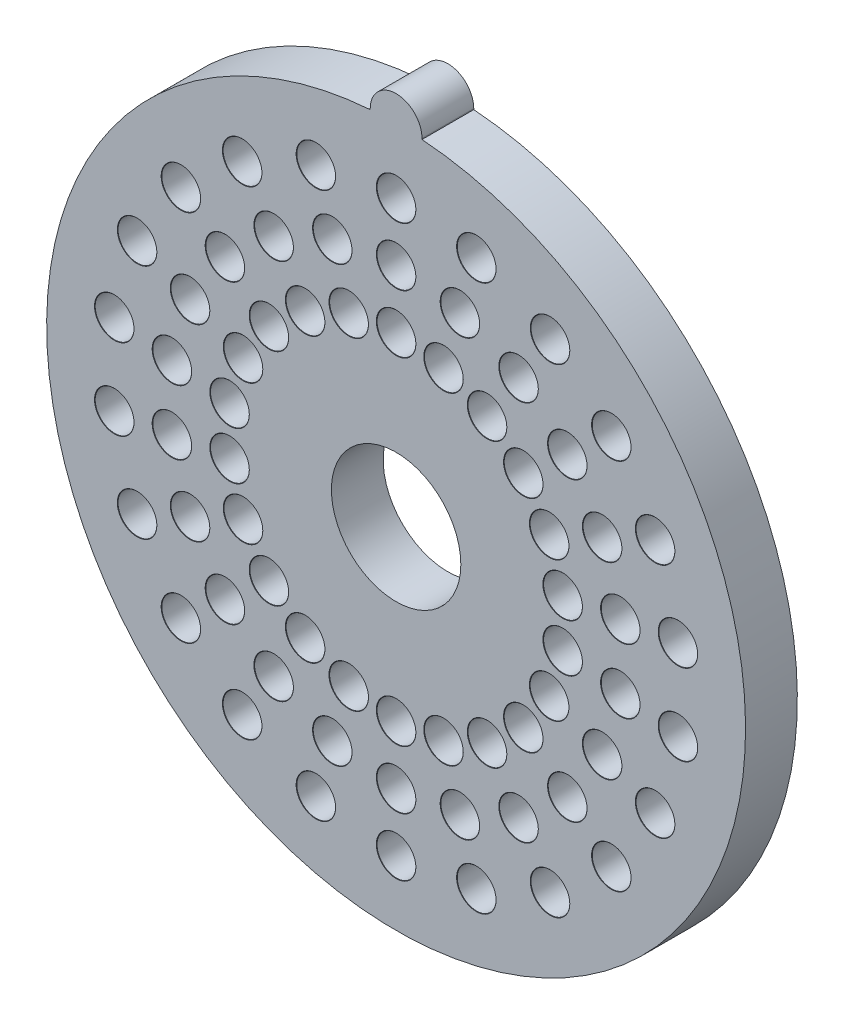
from build123d import *

# Parameters (mm, degrees)
BOSS_EXTRUDE1_DEPTH             = 4
F_3_0MM_DOWEL_HOLE1_D           = 3
F_3_0MM_DOWEL_HOLE1_CSINK_D     = 3.05
F_3_0MM_DOWEL_HOLE1_CSINK_ANGLE = 90
LPATTERN1_COUNT                 = 3
LPATTERN1_PITCH                 = 4.5
CIRPATTERN2_COUNT               = 22
CIRPATTERN2_COPY_1_D            = 3
CIRPATTERN2_COPY_1_CSINK_D      = 3.05
CIRPATTERN2_COPY_1_CSINK_ANGLE  = 90
CIRPATTERN2_COPY_2_D            = 3
CIRPATTERN2_COPY_2_CSINK_D      = 3.05
CIRPATTERN2_COPY_2_CSINK_ANGLE  = 90
CIRPATTERN2_COPY_3_D            = 3
CIRPATTERN2_COPY_3_CSINK_D      = 3.05
CIRPATTERN2_COPY_3_CSINK_ANGLE  = 90
CIRPATTERN2_COPY_4_D            = 3
CIRPATTERN2_COPY_4_CSINK_D      = 3.05
CIRPATTERN2_COPY_4_CSINK_ANGLE  = 90
CIRPATTERN2_COPY_5_D            = 3
CIRPATTERN2_COPY_5_CSINK_D      = 3.05
CIRPATTERN2_COPY_5_CSINK_ANGLE  = 90
CIRPATTERN2_COPY_6_D            = 3
CIRPATTERN2_COPY_6_CSINK_D      = 3.05
CIRPATTERN2_COPY_6_CSINK_ANGLE  = 90
CIRPATTERN2_COPY_7_D            = 3
CIRPATTERN2_COPY_7_CSINK_D      = 3.05
CIRPATTERN2_COPY_7_CSINK_ANGLE  = 90
CIRPATTERN2_COPY_8_D            = 3
CIRPATTERN2_COPY_8_CSINK_D      = 3.05
CIRPATTERN2_COPY_8_CSINK_ANGLE  = 90
CIRPATTERN2_COPY_9_D            = 3
CIRPATTERN2_COPY_9_CSINK_D      = 3.05
CIRPATTERN2_COPY_9_CSINK_ANGLE  = 90
CIRPATTERN2_COPY_10_D           = 3
CIRPATTERN2_COPY_10_CSINK_D     = 3.05
CIRPATTERN2_COPY_10_CSINK_ANGLE = 90
CIRPATTERN2_COPY_11_D           = 3
CIRPATTERN2_COPY_11_CSINK_D     = 3.05
CIRPATTERN2_COPY_11_CSINK_ANGLE = 90
CIRPATTERN2_COPY_12_D           = 3
CIRPATTERN2_COPY_12_CSINK_D     = 3.05
CIRPATTERN2_COPY_12_CSINK_ANGLE = 90
CIRPATTERN2_COPY_13_D           = 3
CIRPATTERN2_COPY_13_CSINK_D     = 3.05
CIRPATTERN2_COPY_13_CSINK_ANGLE = 90
CIRPATTERN2_COPY_14_D           = 3
CIRPATTERN2_COPY_14_CSINK_D     = 3.05
CIRPATTERN2_COPY_14_CSINK_ANGLE = 90
CIRPATTERN2_COPY_15_D           = 3
CIRPATTERN2_COPY_15_CSINK_D     = 3.05
CIRPATTERN2_COPY_15_CSINK_ANGLE = 90
CIRPATTERN2_COPY_16_D           = 3
CIRPATTERN2_COPY_16_CSINK_D     = 3.05
CIRPATTERN2_COPY_16_CSINK_ANGLE = 90
CIRPATTERN2_COPY_17_D           = 3
CIRPATTERN2_COPY_17_CSINK_D     = 3.05
CIRPATTERN2_COPY_17_CSINK_ANGLE = 90
CIRPATTERN2_COPY_18_D           = 3
CIRPATTERN2_COPY_18_CSINK_D     = 3.05
CIRPATTERN2_COPY_18_CSINK_ANGLE = 90
CIRPATTERN2_COPY_19_D           = 3
CIRPATTERN2_COPY_19_CSINK_D     = 3.05
CIRPATTERN2_COPY_19_CSINK_ANGLE = 90
CIRPATTERN2_COPY_20_D           = 3
CIRPATTERN2_COPY_20_CSINK_D     = 3.05
CIRPATTERN2_COPY_20_CSINK_ANGLE = 90
CIRPATTERN2_COPY_21_D           = 3
CIRPATTERN2_COPY_21_CSINK_D     = 3.05
CIRPATTERN2_COPY_21_CSINK_ANGLE = 90
CIRPATTERN2_COPY_22_D           = 3
CIRPATTERN2_COPY_22_CSINK_D     = 3.05
CIRPATTERN2_COPY_22_CSINK_ANGLE = 90
CIRPATTERN2_COPY_23_D           = 3
CIRPATTERN2_COPY_23_CSINK_D     = 3.05
CIRPATTERN2_COPY_23_CSINK_ANGLE = 90
CIRPATTERN2_COPY_24_D           = 3
CIRPATTERN2_COPY_24_CSINK_D     = 3.05
CIRPATTERN2_COPY_24_CSINK_ANGLE = 90
CIRPATTERN2_COPY_25_D           = 3
CIRPATTERN2_COPY_25_CSINK_D     = 3.05
CIRPATTERN2_COPY_25_CSINK_ANGLE = 90
CIRPATTERN2_COPY_26_D           = 3
CIRPATTERN2_COPY_26_CSINK_D     = 3.05
CIRPATTERN2_COPY_26_CSINK_ANGLE = 90
CIRPATTERN2_COPY_27_D           = 3
CIRPATTERN2_COPY_27_CSINK_D     = 3.05
CIRPATTERN2_COPY_27_CSINK_ANGLE = 90
CIRPATTERN2_COPY_28_D           = 3
CIRPATTERN2_COPY_28_CSINK_D     = 3.05
CIRPATTERN2_COPY_28_CSINK_ANGLE = 90
CIRPATTERN2_COPY_29_D           = 3
CIRPATTERN2_COPY_29_CSINK_D     = 3.05
CIRPATTERN2_COPY_29_CSINK_ANGLE = 90
CIRPATTERN2_COPY_30_D           = 3
CIRPATTERN2_COPY_30_CSINK_D     = 3.05
CIRPATTERN2_COPY_30_CSINK_ANGLE = 90
CIRPATTERN2_COPY_31_D           = 3
CIRPATTERN2_COPY_31_CSINK_D     = 3.05
CIRPATTERN2_COPY_31_CSINK_ANGLE = 90
CIRPATTERN2_COPY_32_D           = 3
CIRPATTERN2_COPY_32_CSINK_D     = 3.05
CIRPATTERN2_COPY_32_CSINK_ANGLE = 90
CIRPATTERN2_COPY_33_D           = 3
CIRPATTERN2_COPY_33_CSINK_D     = 3.05
CIRPATTERN2_COPY_33_CSINK_ANGLE = 90
CIRPATTERN2_COPY_34_D           = 3
CIRPATTERN2_COPY_34_CSINK_D     = 3.05
CIRPATTERN2_COPY_34_CSINK_ANGLE = 90
CIRPATTERN2_COPY_35_D           = 3
CIRPATTERN2_COPY_35_CSINK_D     = 3.05
CIRPATTERN2_COPY_35_CSINK_ANGLE = 90
CIRPATTERN2_COPY_36_D           = 3
CIRPATTERN2_COPY_36_CSINK_D     = 3.05
CIRPATTERN2_COPY_36_CSINK_ANGLE = 90
CIRPATTERN2_COPY_37_D           = 3
CIRPATTERN2_COPY_37_CSINK_D     = 3.05
CIRPATTERN2_COPY_37_CSINK_ANGLE = 90
CIRPATTERN2_COPY_38_D           = 3
CIRPATTERN2_COPY_38_CSINK_D     = 3.05
CIRPATTERN2_COPY_38_CSINK_ANGLE = 90
CIRPATTERN2_COPY_39_D           = 3
CIRPATTERN2_COPY_39_CSINK_D     = 3.05
CIRPATTERN2_COPY_39_CSINK_ANGLE = 90
CIRPATTERN2_COPY_40_D           = 3
CIRPATTERN2_COPY_40_CSINK_D     = 3.05
CIRPATTERN2_COPY_40_CSINK_ANGLE = 90
CIRPATTERN2_COPY_41_D           = 3
CIRPATTERN2_COPY_41_CSINK_D     = 3.05
CIRPATTERN2_COPY_41_CSINK_ANGLE = 90
CIRPATTERN2_COPY_42_D           = 3
CIRPATTERN2_COPY_42_CSINK_D     = 3.05
CIRPATTERN2_COPY_42_CSINK_ANGLE = 90
SKETCH4_R                       = 5
CUT_EXTRUDE1_DEPTH              = 40.824615503


with BuildPart() as part:
    # Sketch1 → Boss-Extrude1 (new body)
    with BuildSketch(Plane.XY):
        with BuildLine():
            Line((-2, 26.925824036), (-2, 27))
            ThreePointArc((-2, 27), (0, 29), (2, 27))
            Line((2, 27), (2, 26.925824036))
            ThreePointArc((2, 26.925824036), (0, -27), (-2, 26.925824036))
        make_face()
    extrude(amount=BOSS_EXTRUDE1_DEPTH)

    # Ø3.0mm Dowel Hole1 (through all)
    with Locations(Plane.XY.offset(4)):
        with Locations((0, 22)):
            f_3_0mm_dowel_hole1 = CounterSinkHole(F_3_0MM_DOWEL_HOLE1_D / 2, F_3_0MM_DOWEL_HOLE1_CSINK_D / 2, counter_sink_angle=F_3_0MM_DOWEL_HOLE1_CSINK_ANGLE)

    # LPattern1: Ø3.0mm Dowel Hole1 ×3
    with Locations(*[(0, -i * LPATTERN1_PITCH, 0) for i in range(1, LPATTERN1_COUNT)]):
        add(f_3_0mm_dowel_hole1, mode=Mode.SUBTRACT)

    # CirPattern2: Ø3.0mm Dowel Hole1 ×22 about axis
    cirpattern2_axis = Axis((0, 0, 0), (0, 0, 1))
    for i in range(1, CIRPATTERN2_COUNT):
        add(f_3_0mm_dowel_hole1.rotate(cirpattern2_axis, i * 360 / CIRPATTERN2_COUNT), mode=Mode.SUBTRACT)

    # CirPattern2 copy 1 (through all)
    with Locations(Plane(origin=(1.267796506, -4.317718381, 4), x_dir=(0.9594929736144974, 0.28173255684142967, 0), z_dir=(0, 0, 1))):
        with Locations((0, 22)):
            CounterSinkHole(CIRPATTERN2_COPY_1_D / 2, CIRPATTERN2_COPY_1_CSINK_D / 2, counter_sink_angle=CIRPATTERN2_COPY_1_CSINK_ANGLE)

    # CirPattern2 copy 2 (through all)
    with Locations(Plane(origin=(2.432883679, -3.785640898, 4), x_dir=(0.8412535328311812, 0.5406408174555976, 0), z_dir=(0, 0, 1))):
        with Locations((0, 22)):
            CounterSinkHole(CIRPATTERN2_COPY_2_D / 2, CIRPATTERN2_COPY_2_CSINK_D / 2, counter_sink_angle=CIRPATTERN2_COPY_2_CSINK_ANGLE)

    # CirPattern2 copy 3 (through all)
    with Locations(Plane(origin=(3.400873085, -2.946873303, 4), x_dir=(0.654860733945285, 0.7557495743542583, 0), z_dir=(0, 0, 1))):
        with Locations((0, 22)):
            CounterSinkHole(CIRPATTERN2_COPY_3_D / 2, CIRPATTERN2_COPY_3_CSINK_D / 2, counter_sink_angle=CIRPATTERN2_COPY_3_CSINK_ANGLE)

    # CirPattern2 copy 4 (through all)
    with Locations(Plane(origin=(4.093343979, -1.869367559, 4), x_dir=(0.41541501300188644, 0.9096319953545183, 0), z_dir=(0, 0, 1))):
        with Locations((0, 22)):
            CounterSinkHole(CIRPATTERN2_COPY_4_D / 2, CIRPATTERN2_COPY_4_CSINK_D / 2, counter_sink_angle=CIRPATTERN2_COPY_4_CSINK_ANGLE)

    # CirPattern2 copy 5 (through all)
    with Locations(Plane(origin=(4.454196488, -0.640416772, 4), x_dir=(0.14231483827328534, 0.9898214418809327, 0), z_dir=(0, 0, 1))):
        with Locations((0, 22)):
            CounterSinkHole(CIRPATTERN2_COPY_5_D / 2, CIRPATTERN2_COPY_5_CSINK_D / 2, counter_sink_angle=CIRPATTERN2_COPY_5_CSINK_ANGLE)

    # CirPattern2 copy 6 (through all)
    with Locations(Plane(origin=(4.454196488, 0.640416772, 4), x_dir=(-0.14231483827328523, 0.9898214418809327, 0), z_dir=(0, 0, 1))):
        with Locations((0, 22)):
            CounterSinkHole(CIRPATTERN2_COPY_6_D / 2, CIRPATTERN2_COPY_6_CSINK_D / 2, counter_sink_angle=CIRPATTERN2_COPY_6_CSINK_ANGLE)

    # CirPattern2 copy 7 (through all)
    with Locations(Plane(origin=(4.093343979, 1.869367559, 4), x_dir=(-0.4154150130018863, 0.9096319953545184, 0), z_dir=(0, 0, 1))):
        with Locations((0, 22)):
            CounterSinkHole(CIRPATTERN2_COPY_7_D / 2, CIRPATTERN2_COPY_7_CSINK_D / 2, counter_sink_angle=CIRPATTERN2_COPY_7_CSINK_ANGLE)

    # CirPattern2 copy 8 (through all)
    with Locations(Plane(origin=(3.400873085, 2.946873303, 4), x_dir=(-0.654860733945285, 0.7557495743542583, 0), z_dir=(0, 0, 1))):
        with Locations((0, 22)):
            CounterSinkHole(CIRPATTERN2_COPY_8_D / 2, CIRPATTERN2_COPY_8_CSINK_D / 2, counter_sink_angle=CIRPATTERN2_COPY_8_CSINK_ANGLE)

    # CirPattern2 copy 9 (through all)
    with Locations(Plane(origin=(2.432883679, 3.785640898, 4), x_dir=(-0.8412535328311813, 0.5406408174555974, 0), z_dir=(0, 0, 1))):
        with Locations((0, 22)):
            CounterSinkHole(CIRPATTERN2_COPY_9_D / 2, CIRPATTERN2_COPY_9_CSINK_D / 2, counter_sink_angle=CIRPATTERN2_COPY_9_CSINK_ANGLE)

    # CirPattern2 copy 10 (through all)
    with Locations(Plane(origin=(1.267796506, 4.317718381, 4), x_dir=(-0.9594929736144973, 0.28173255684143006, 0), z_dir=(0, 0, 1))):
        with Locations((0, 22)):
            CounterSinkHole(CIRPATTERN2_COPY_10_D / 2, CIRPATTERN2_COPY_10_CSINK_D / 2, counter_sink_angle=CIRPATTERN2_COPY_10_CSINK_ANGLE)

    # CirPattern2 copy 11 (through all)
    with Locations(Plane(origin=(0, 4.5, 4), x_dir=(-1, 0, 0), z_dir=(0, 0, 1))):
        with Locations((0, 22)):
            CounterSinkHole(CIRPATTERN2_COPY_11_D / 2, CIRPATTERN2_COPY_11_CSINK_D / 2, counter_sink_angle=CIRPATTERN2_COPY_11_CSINK_ANGLE)

    # CirPattern2 copy 12 (through all)
    with Locations(Plane(origin=(-1.267796506, 4.317718381, 4), x_dir=(-0.9594929736144974, -0.28173255684142984, 0), z_dir=(0, 0, 1))):
        with Locations((0, 22)):
            CounterSinkHole(CIRPATTERN2_COPY_12_D / 2, CIRPATTERN2_COPY_12_CSINK_D / 2, counter_sink_angle=CIRPATTERN2_COPY_12_CSINK_ANGLE)

    # CirPattern2 copy 13 (through all)
    with Locations(Plane(origin=(-2.432883679, 3.785640898, 4), x_dir=(-0.8412535328311812, -0.5406408174555976, 0), z_dir=(0, 0, 1))):
        with Locations((0, 22)):
            CounterSinkHole(CIRPATTERN2_COPY_13_D / 2, CIRPATTERN2_COPY_13_CSINK_D / 2, counter_sink_angle=CIRPATTERN2_COPY_13_CSINK_ANGLE)

    # CirPattern2 copy 14 (through all)
    with Locations(Plane(origin=(-3.400873085, 2.946873303, 4), x_dir=(-0.6548607339452852, -0.7557495743542582, 0), z_dir=(0, 0, 1))):
        with Locations((0, 22)):
            CounterSinkHole(CIRPATTERN2_COPY_14_D / 2, CIRPATTERN2_COPY_14_CSINK_D / 2, counter_sink_angle=CIRPATTERN2_COPY_14_CSINK_ANGLE)

    # CirPattern2 copy 15 (through all)
    with Locations(Plane(origin=(-4.093343979, 1.869367559, 4), x_dir=(-0.4154150130018864, -0.9096319953545184, 0), z_dir=(0, 0, 1))):
        with Locations((0, 22)):
            CounterSinkHole(CIRPATTERN2_COPY_15_D / 2, CIRPATTERN2_COPY_15_CSINK_D / 2, counter_sink_angle=CIRPATTERN2_COPY_15_CSINK_ANGLE)

    # CirPattern2 copy 16 (through all)
    with Locations(Plane(origin=(-4.454196488, 0.640416772, 4), x_dir=(-0.14231483827328523, -0.9898214418809327, 0), z_dir=(0, 0, 1))):
        with Locations((0, 22)):
            CounterSinkHole(CIRPATTERN2_COPY_16_D / 2, CIRPATTERN2_COPY_16_CSINK_D / 2, counter_sink_angle=CIRPATTERN2_COPY_16_CSINK_ANGLE)

    # CirPattern2 copy 17 (through all)
    with Locations(Plane(origin=(-4.454196488, -0.640416772, 4), x_dir=(0.14231483827328487, -0.9898214418809328, 0), z_dir=(0, 0, 1))):
        with Locations((0, 22)):
            CounterSinkHole(CIRPATTERN2_COPY_17_D / 2, CIRPATTERN2_COPY_17_CSINK_D / 2, counter_sink_angle=CIRPATTERN2_COPY_17_CSINK_ANGLE)

    # CirPattern2 copy 18 (through all)
    with Locations(Plane(origin=(-4.093343979, -1.869367559, 4), x_dir=(0.4154150130018868, -0.9096319953545182, 0), z_dir=(0, 0, 1))):
        with Locations((0, 22)):
            CounterSinkHole(CIRPATTERN2_COPY_18_D / 2, CIRPATTERN2_COPY_18_CSINK_D / 2, counter_sink_angle=CIRPATTERN2_COPY_18_CSINK_ANGLE)

    # CirPattern2 copy 19 (through all)
    with Locations(Plane(origin=(-3.400873085, -2.946873303, 4), x_dir=(0.6548607339452845, -0.7557495743542587, 0), z_dir=(0, 0, 1))):
        with Locations((0, 22)):
            CounterSinkHole(CIRPATTERN2_COPY_19_D / 2, CIRPATTERN2_COPY_19_CSINK_D / 2, counter_sink_angle=CIRPATTERN2_COPY_19_CSINK_ANGLE)

    # CirPattern2 copy 20 (through all)
    with Locations(Plane(origin=(-2.432883679, -3.785640898, 4), x_dir=(0.8412535328311808, -0.5406408174555982, 0), z_dir=(0, 0, 1))):
        with Locations((0, 22)):
            CounterSinkHole(CIRPATTERN2_COPY_20_D / 2, CIRPATTERN2_COPY_20_CSINK_D / 2, counter_sink_angle=CIRPATTERN2_COPY_20_CSINK_ANGLE)

    # CirPattern2 copy 21 (through all)
    with Locations(Plane(origin=(-1.267796506, -4.317718381, 4), x_dir=(0.9594929736144974, -0.2817325568414298, 0), z_dir=(0, 0, 1))):
        with Locations((0, 22)):
            CounterSinkHole(CIRPATTERN2_COPY_21_D / 2, CIRPATTERN2_COPY_21_CSINK_D / 2, counter_sink_angle=CIRPATTERN2_COPY_21_CSINK_ANGLE)

    # CirPattern2 copy 22 (through all)
    with Locations(Plane(origin=(2.535593012, -8.635436763, 4), x_dir=(0.9594929736144974, 0.28173255684142967, 0), z_dir=(0, 0, 1))):
        with Locations((0, 22)):
            CounterSinkHole(CIRPATTERN2_COPY_22_D / 2, CIRPATTERN2_COPY_22_CSINK_D / 2, counter_sink_angle=CIRPATTERN2_COPY_22_CSINK_ANGLE)

    # CirPattern2 copy 23 (through all)
    with Locations(Plane(origin=(4.865767357, -7.571281795, 4), x_dir=(0.8412535328311812, 0.5406408174555976, 0), z_dir=(0, 0, 1))):
        with Locations((0, 22)):
            CounterSinkHole(CIRPATTERN2_COPY_23_D / 2, CIRPATTERN2_COPY_23_CSINK_D / 2, counter_sink_angle=CIRPATTERN2_COPY_23_CSINK_ANGLE)

    # CirPattern2 copy 24 (through all)
    with Locations(Plane(origin=(6.801746169, -5.893746606, 4), x_dir=(0.654860733945285, 0.7557495743542583, 0), z_dir=(0, 0, 1))):
        with Locations((0, 22)):
            CounterSinkHole(CIRPATTERN2_COPY_24_D / 2, CIRPATTERN2_COPY_24_CSINK_D / 2, counter_sink_angle=CIRPATTERN2_COPY_24_CSINK_ANGLE)

    # CirPattern2 copy 25 (through all)
    with Locations(Plane(origin=(8.186687958, -3.738735117, 4), x_dir=(0.41541501300188644, 0.9096319953545183, 0), z_dir=(0, 0, 1))):
        with Locations((0, 22)):
            CounterSinkHole(CIRPATTERN2_COPY_25_D / 2, CIRPATTERN2_COPY_25_CSINK_D / 2, counter_sink_angle=CIRPATTERN2_COPY_25_CSINK_ANGLE)

    # CirPattern2 copy 26 (through all)
    with Locations(Plane(origin=(8.908392977, -1.280833544, 4), x_dir=(0.14231483827328534, 0.9898214418809327, 0), z_dir=(0, 0, 1))):
        with Locations((0, 22)):
            CounterSinkHole(CIRPATTERN2_COPY_26_D / 2, CIRPATTERN2_COPY_26_CSINK_D / 2, counter_sink_angle=CIRPATTERN2_COPY_26_CSINK_ANGLE)

    # CirPattern2 copy 27 (through all)
    with Locations(Plane(origin=(8.908392977, 1.280833544, 4), x_dir=(-0.14231483827328523, 0.9898214418809327, 0), z_dir=(0, 0, 1))):
        with Locations((0, 22)):
            CounterSinkHole(CIRPATTERN2_COPY_27_D / 2, CIRPATTERN2_COPY_27_CSINK_D / 2, counter_sink_angle=CIRPATTERN2_COPY_27_CSINK_ANGLE)

    # CirPattern2 copy 28 (through all)
    with Locations(Plane(origin=(8.186687958, 3.738735117, 4), x_dir=(-0.4154150130018863, 0.9096319953545184, 0), z_dir=(0, 0, 1))):
        with Locations((0, 22)):
            CounterSinkHole(CIRPATTERN2_COPY_28_D / 2, CIRPATTERN2_COPY_28_CSINK_D / 2, counter_sink_angle=CIRPATTERN2_COPY_28_CSINK_ANGLE)

    # CirPattern2 copy 29 (through all)
    with Locations(Plane(origin=(6.801746169, 5.893746606, 4), x_dir=(-0.654860733945285, 0.7557495743542583, 0), z_dir=(0, 0, 1))):
        with Locations((0, 22)):
            CounterSinkHole(CIRPATTERN2_COPY_29_D / 2, CIRPATTERN2_COPY_29_CSINK_D / 2, counter_sink_angle=CIRPATTERN2_COPY_29_CSINK_ANGLE)

    # CirPattern2 copy 30 (through all)
    with Locations(Plane(origin=(4.865767357, 7.571281795, 4), x_dir=(-0.8412535328311813, 0.5406408174555974, 0), z_dir=(0, 0, 1))):
        with Locations((0, 22)):
            CounterSinkHole(CIRPATTERN2_COPY_30_D / 2, CIRPATTERN2_COPY_30_CSINK_D / 2, counter_sink_angle=CIRPATTERN2_COPY_30_CSINK_ANGLE)

    # CirPattern2 copy 31 (through all)
    with Locations(Plane(origin=(2.535593012, 8.635436763, 4), x_dir=(-0.9594929736144973, 0.28173255684143006, 0), z_dir=(0, 0, 1))):
        with Locations((0, 22)):
            CounterSinkHole(CIRPATTERN2_COPY_31_D / 2, CIRPATTERN2_COPY_31_CSINK_D / 2, counter_sink_angle=CIRPATTERN2_COPY_31_CSINK_ANGLE)

    # CirPattern2 copy 32 (through all)
    with Locations(Plane(origin=(0, 9, 4), x_dir=(-1, 0, 0), z_dir=(0, 0, 1))):
        with Locations((0, 22)):
            CounterSinkHole(CIRPATTERN2_COPY_32_D / 2, CIRPATTERN2_COPY_32_CSINK_D / 2, counter_sink_angle=CIRPATTERN2_COPY_32_CSINK_ANGLE)

    # CirPattern2 copy 33 (through all)
    with Locations(Plane(origin=(-2.535593012, 8.635436763, 4), x_dir=(-0.9594929736144974, -0.28173255684142984, 0), z_dir=(0, 0, 1))):
        with Locations((0, 22)):
            CounterSinkHole(CIRPATTERN2_COPY_33_D / 2, CIRPATTERN2_COPY_33_CSINK_D / 2, counter_sink_angle=CIRPATTERN2_COPY_33_CSINK_ANGLE)

    # CirPattern2 copy 34 (through all)
    with Locations(Plane(origin=(-4.865767357, 7.571281795, 4), x_dir=(-0.8412535328311812, -0.5406408174555976, 0), z_dir=(0, 0, 1))):
        with Locations((0, 22)):
            CounterSinkHole(CIRPATTERN2_COPY_34_D / 2, CIRPATTERN2_COPY_34_CSINK_D / 2, counter_sink_angle=CIRPATTERN2_COPY_34_CSINK_ANGLE)

    # CirPattern2 copy 35 (through all)
    with Locations(Plane(origin=(-6.801746169, 5.893746606, 4), x_dir=(-0.6548607339452852, -0.7557495743542582, 0), z_dir=(0, 0, 1))):
        with Locations((0, 22)):
            CounterSinkHole(CIRPATTERN2_COPY_35_D / 2, CIRPATTERN2_COPY_35_CSINK_D / 2, counter_sink_angle=CIRPATTERN2_COPY_35_CSINK_ANGLE)

    # CirPattern2 copy 36 (through all)
    with Locations(Plane(origin=(-8.186687958, 3.738735117, 4), x_dir=(-0.4154150130018864, -0.9096319953545184, 0), z_dir=(0, 0, 1))):
        with Locations((0, 22)):
            CounterSinkHole(CIRPATTERN2_COPY_36_D / 2, CIRPATTERN2_COPY_36_CSINK_D / 2, counter_sink_angle=CIRPATTERN2_COPY_36_CSINK_ANGLE)

    # CirPattern2 copy 37 (through all)
    with Locations(Plane(origin=(-8.908392977, 1.280833544, 4), x_dir=(-0.14231483827328523, -0.9898214418809327, 0), z_dir=(0, 0, 1))):
        with Locations((0, 22)):
            CounterSinkHole(CIRPATTERN2_COPY_37_D / 2, CIRPATTERN2_COPY_37_CSINK_D / 2, counter_sink_angle=CIRPATTERN2_COPY_37_CSINK_ANGLE)

    # CirPattern2 copy 38 (through all)
    with Locations(Plane(origin=(-8.908392977, -1.280833544, 4), x_dir=(0.14231483827328487, -0.9898214418809328, 0), z_dir=(0, 0, 1))):
        with Locations((0, 22)):
            CounterSinkHole(CIRPATTERN2_COPY_38_D / 2, CIRPATTERN2_COPY_38_CSINK_D / 2, counter_sink_angle=CIRPATTERN2_COPY_38_CSINK_ANGLE)

    # CirPattern2 copy 39 (through all)
    with Locations(Plane(origin=(-8.186687958, -3.738735117, 4), x_dir=(0.4154150130018868, -0.9096319953545182, 0), z_dir=(0, 0, 1))):
        with Locations((0, 22)):
            CounterSinkHole(CIRPATTERN2_COPY_39_D / 2, CIRPATTERN2_COPY_39_CSINK_D / 2, counter_sink_angle=CIRPATTERN2_COPY_39_CSINK_ANGLE)

    # CirPattern2 copy 40 (through all)
    with Locations(Plane(origin=(-6.801746169, -5.893746606, 4), x_dir=(0.6548607339452845, -0.7557495743542587, 0), z_dir=(0, 0, 1))):
        with Locations((0, 22)):
            CounterSinkHole(CIRPATTERN2_COPY_40_D / 2, CIRPATTERN2_COPY_40_CSINK_D / 2, counter_sink_angle=CIRPATTERN2_COPY_40_CSINK_ANGLE)

    # CirPattern2 copy 41 (through all)
    with Locations(Plane(origin=(-4.865767357, -7.571281795, 4), x_dir=(0.8412535328311808, -0.5406408174555982, 0), z_dir=(0, 0, 1))):
        with Locations((0, 22)):
            CounterSinkHole(CIRPATTERN2_COPY_41_D / 2, CIRPATTERN2_COPY_41_CSINK_D / 2, counter_sink_angle=CIRPATTERN2_COPY_41_CSINK_ANGLE)

    # CirPattern2 copy 42 (through all)
    with Locations(Plane(origin=(-2.535593012, -8.635436763, 4), x_dir=(0.9594929736144974, -0.2817325568414298, 0), z_dir=(0, 0, 1))):
        with Locations((0, 22)):
            CounterSinkHole(CIRPATTERN2_COPY_42_D / 2, CIRPATTERN2_COPY_42_CSINK_D / 2, counter_sink_angle=CIRPATTERN2_COPY_42_CSINK_ANGLE)

    # Sketch4 → Cut-Extrude1 (cut, through all)
    with BuildSketch(Plane.XY.offset(4)):
        Circle(SKETCH4_R)
    extrude(amount=-CUT_EXTRUDE1_DEPTH, mode=Mode.SUBTRACT)


solid = part.part
